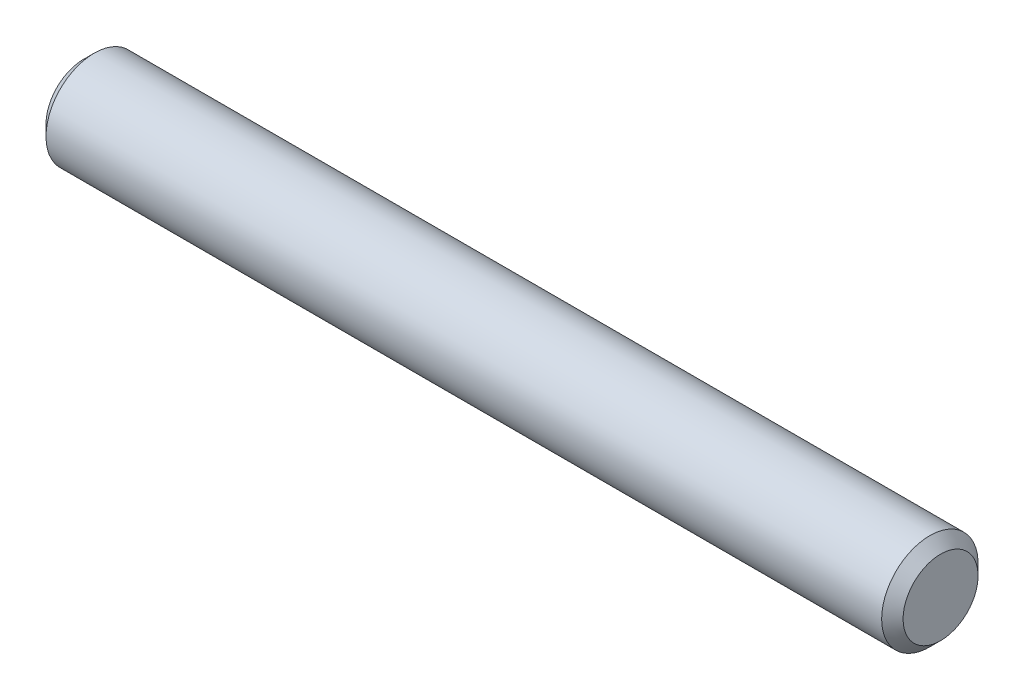
from build123d import *

# Parameters (mm, degrees)
SKETCH_1_W     = 16
SKETCH_1_H     = 0.9
CHAMFER_1_SIZE = 0.2


with BuildPart() as part:
    # 草图1 → 旋转1 (revolve)
    with BuildSketch(Plane.XY, mode=Mode.PRIVATE) as revolve_1_sk:
        with Locations((2.657303371, 0.45)):
            Rectangle(SKETCH_1_W, SKETCH_1_H)
    revolve(revolve_1_sk.sketch.rotate(Axis((-6.320224719, 0, 0), (1, 0, 0)), 90), axis=Axis((-6.320224719, 0, 0), (1, 0, 0)))

    # 倒角1
    chamfer_1_edges = [part.edges().sort_by_distance(p)[0] for p in [
        (10.657303371, 0, -0.9),
        (-5.342696629, 0, -0.9),
    ]]
    chamfer(chamfer_1_edges, length=CHAMFER_1_SIZE)


solid = part.part
